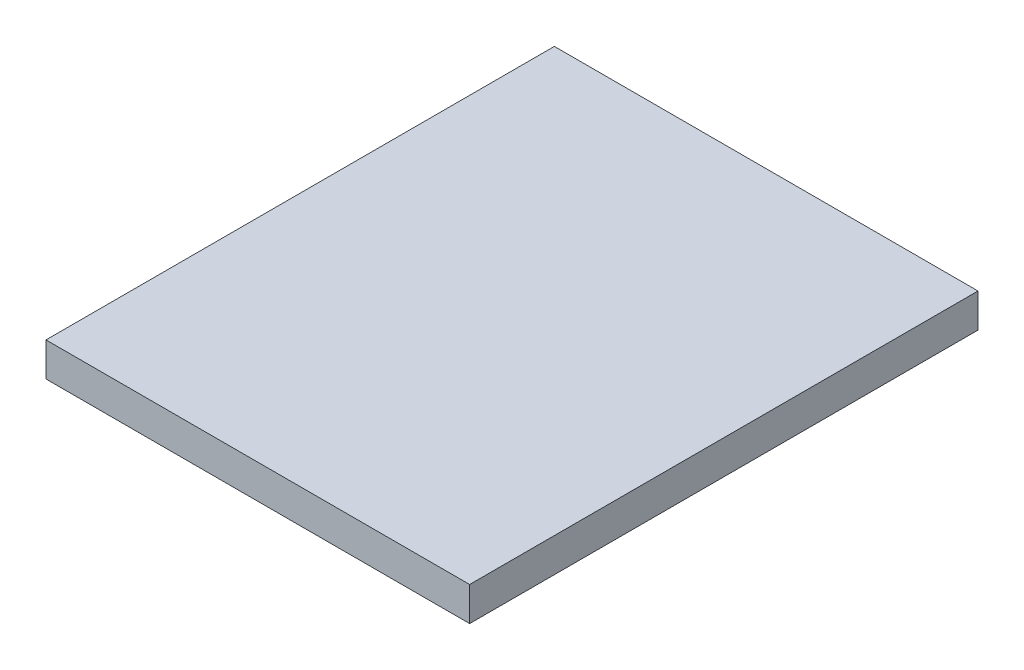
from build123d import *

# Parameters (mm, degrees)
SKETCH1_W           = 100
SKETCH1_H           = 120
BOSS_EXTRUDE1_DEPTH = 8


with BuildPart() as part:
    # Sketch1 → Boss-Extrude1 (new body)
    with BuildSketch(Plane(origin=(0, 0, 0), x_dir=(1, 0, 0), z_dir=(0, 1, 0))):
        Rectangle(SKETCH1_W, SKETCH1_H)
    extrude(amount=BOSS_EXTRUDE1_DEPTH)


solid = part.part
